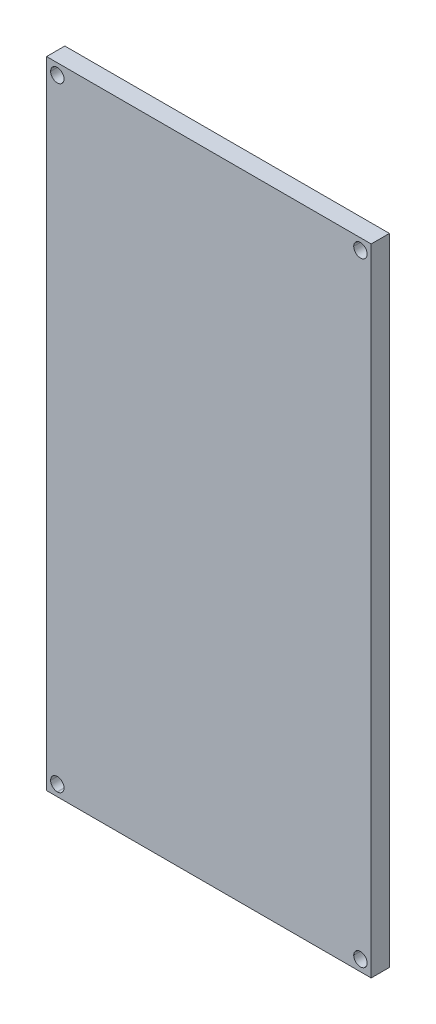
from build123d import *

# Parameters (mm, degrees)
MODEL_W             = 79.999946
MODEL_H             = 156.677783
BOSS_EXTRUDE1_DEPTH = 4.5
SKETCH2_R           = 1.650333
SKETCH2_R_2         = 1.650206
CUT_EXTRUDE1_DEPTH  = 10


with BuildPart() as part:
    # Model → Boss-Extrude1 (new body)
    with BuildSketch(Plane.XY):
        with Locations((1298.935696, -311.751866)):
            Rectangle(MODEL_W, MODEL_H)
        with BuildLine():
            add(Edge.make_bspline(
                [(1334.63552, -236.062935), (1334.63552, -235.15171), (1335.374131, -234.413063), (1336.285708, -234.413063), (1337.196581, -234.413063), (1337.935544, -235.15171), (1337.935544, -236.062935)],
                knots=[2, 2, 2, 2, 3, 3, 3, 4, 4, 4, 4], degree=3))
            add(Edge.make_bspline(
                [(1337.935544, -236.062935), (1337.935544, -236.97416), (1337.196581, -237.713123), (1336.285708, -237.713123), (1335.374131, -237.713123), (1334.63552, -236.97416), (1334.63552, -236.062935)],
                knots=[0, 0, 0, 0, 1, 1, 1, 2, 2, 2, 2], degree=3))
        make_face(mode=Mode.SUBTRACT)
        with BuildLine():
            add(Edge.make_bspline(
                [(1259.935496, -236.062935), (1259.935496, -235.15171), (1260.674142, -234.413063), (1261.585684, -234.413063), (1262.496592, -234.413063), (1263.235555, -235.15171), (1263.235555, -236.062935)],
                knots=[2, 2, 2, 2, 3, 3, 3, 4, 4, 4, 4], degree=3))
            add(Edge.make_bspline(
                [(1263.235555, -236.062935), (1263.235555, -236.97416), (1262.496592, -237.713123), (1261.585684, -237.713123), (1260.674142, -237.713123), (1259.935496, -236.97416), (1259.935496, -236.062935)],
                knots=[0, 0, 0, 0, 1, 1, 1, 2, 2, 2, 2], degree=3))
        make_face(mode=Mode.SUBTRACT)
        with BuildLine():
            add(Edge.make_bspline(
                [(1259.935496, -387.392889), (1259.935496, -386.481664), (1260.674142, -385.743018), (1261.585684, -385.743018), (1262.496592, -385.743018), (1263.235908, -386.481664), (1263.235908, -387.392889)],
                knots=[2, 2, 2, 2, 3, 3, 3, 4, 4, 4, 4], degree=3))
            add(Edge.make_bspline(
                [(1263.235908, -387.392889), (1263.235908, -388.304114), (1262.496592, -389.043078), (1261.585684, -389.043078), (1260.674142, -389.043078), (1259.935496, -388.304114), (1259.935496, -387.392889)],
                knots=[0, 0, 0, 0, 1, 1, 1, 2, 2, 2, 2], degree=3))
        make_face(mode=Mode.SUBTRACT)
        with BuildLine():
            add(Edge.make_bspline(
                [(1334.63552, -387.392889), (1334.63552, -386.481664), (1335.374131, -385.743018), (1336.285708, -385.743018), (1337.196581, -385.743018), (1337.935897, -386.481664), (1337.935897, -387.392889)],
                knots=[2, 2, 2, 2, 3, 3, 3, 4, 4, 4, 4], degree=3))
            add(Edge.make_bspline(
                [(1337.935897, -387.392889), (1337.935897, -388.304114), (1337.196581, -389.043078), (1336.285708, -389.043078), (1335.374131, -389.043078), (1334.63552, -388.304114), (1334.63552, -387.392889)],
                knots=[0, 0, 0, 0, 1, 1, 1, 2, 2, 2, 2], degree=3))
        make_face(mode=Mode.SUBTRACT)
    extrude(amount=BOSS_EXTRUDE1_DEPTH)

    # Sketch2 → Cut-Extrude1 (cut)
    with BuildSketch(Plane.XY.offset(4.5)):
        with Locations((1336.285532, -236.095454)):
            Circle(SKETCH2_R)
        with Locations((1261.585702, -387.392889)):
            Circle(SKETCH2_R_2)
    extrude(amount=-CUT_EXTRUDE1_DEPTH, mode=Mode.SUBTRACT)


solid = part.part
